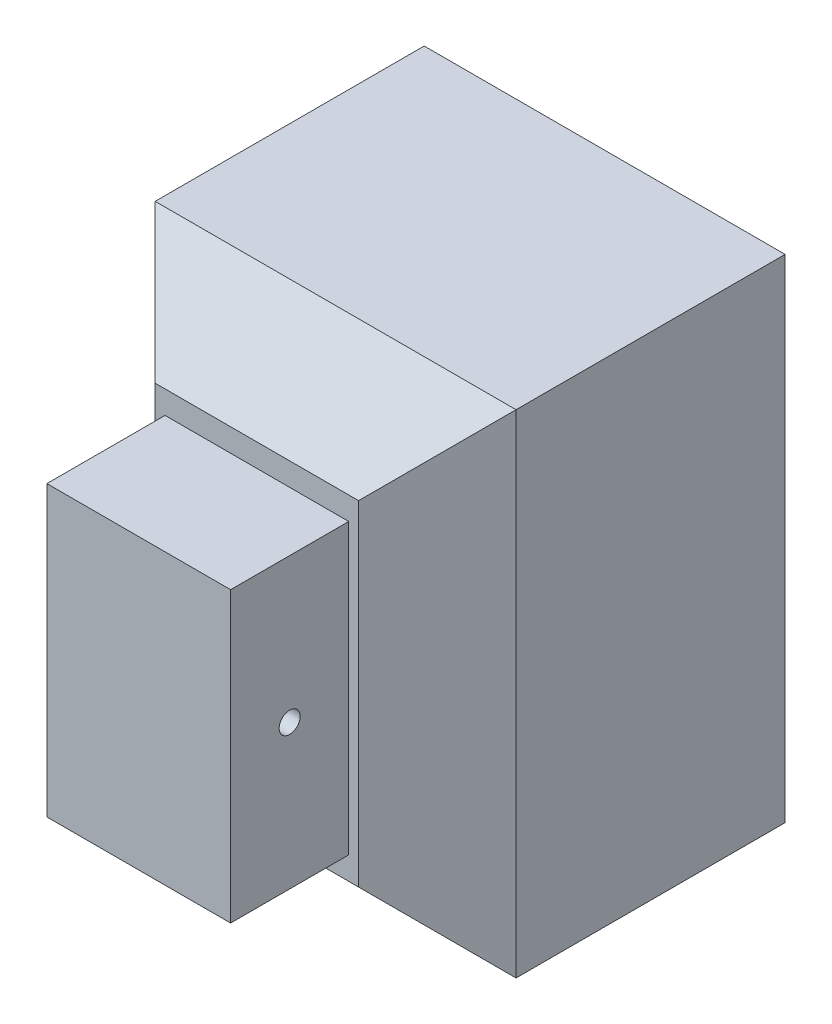
from build123d import *

# Parameters (mm, degrees)
SKETCH1_W               = 75
SKETCH1_H               = 65
BOSS_EXTRUDE1_DEPTH     = 55
SKETCH2_W               = 28
SKETCH2_H               = 44
BOSS_EXTRUDE2_DEPTH     = 18
CHAMFER1_SIZE           = 12
CUT_EXTRUDE1_DEPTH      = 77.154844523
CUT_EXTRUDE1_DEPTH_BACK = 77.154844523
SKETCH3_R               = 1.6


with BuildPart() as part:
    # Sketch1 → Boss-Extrude1 (new body)
    with BuildSketch(Plane.YZ):
        with Locations((5.396678967, -3.201107011)):
            Rectangle(SKETCH1_W, SKETCH1_H)
    extrude(amount=BOSS_EXTRUDE1_DEPTH)

    # Sketch2 → Boss-Extrude2 (add)
    with BuildSketch(Plane.XY.offset(29.298892989)):
        with Locations((27.5, 5.396678967)):
            Rectangle(SKETCH2_W, SKETCH2_H)
    extrude(amount=BOSS_EXTRUDE2_DEPTH)

    # Chamfer1
    chamfer1_edges = [part.edges().sort_by_distance(p)[0] for p in [
        (55, 5.396678967, 29.298892989),
        (0, 5.396678967, 29.298892989),
        (0, 5.396678967, -35.701107011),
        (27.5, -32.103321033, 29.298892989),
        (27.5, 42.896678967, 29.298892989),
        (27.5, 42.896678967, -35.701107011),
        (27.5, -32.103321033, -35.701107011),
        (55, 5.396678967, -35.701107011),
    ]]
    chamfer(chamfer1_edges, length=CHAMFER1_SIZE)

    # Sketch3 → Cut-Extrude1 (cut, two sides: drawn at the far end of the back side and taken through both)
    with BuildSketch(Plane.YZ.offset(41.5).offset(-CUT_EXTRUDE1_DEPTH_BACK)):
        with Locations((5.396678967, 38.298892989)):
            Circle(SKETCH3_R)
    extrude(amount=CUT_EXTRUDE1_DEPTH + CUT_EXTRUDE1_DEPTH_BACK, mode=Mode.SUBTRACT)


solid = part.part
